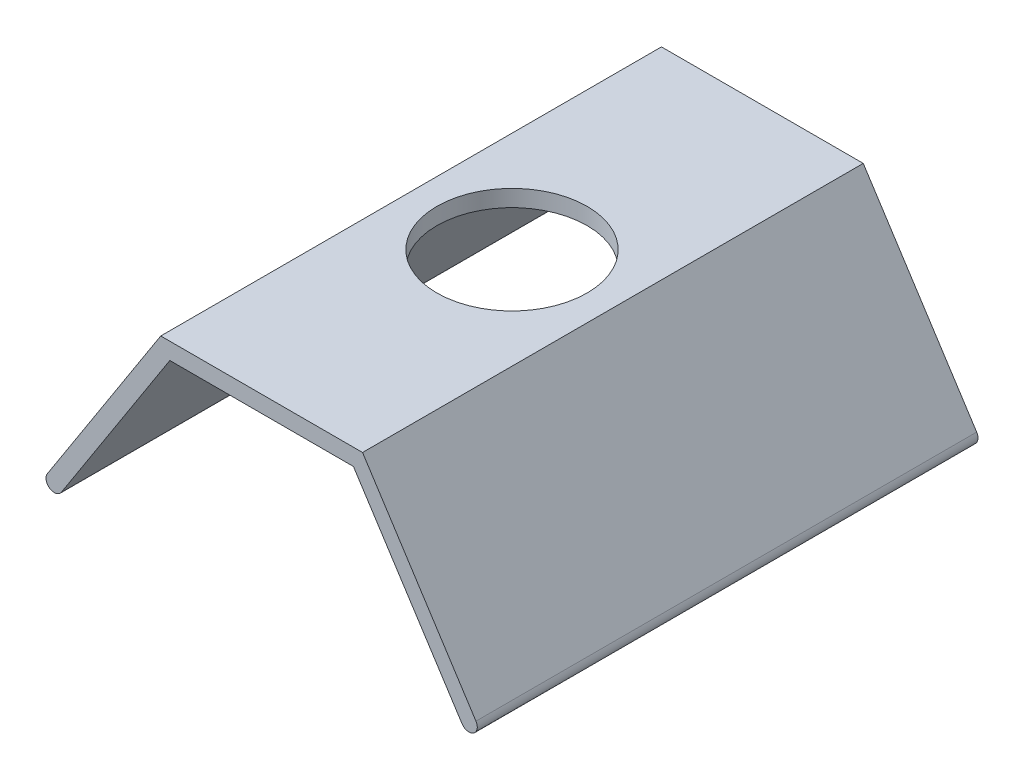
from build123d import *

# Parameters (mm, degrees)
BOSS_EXTRUDE1_DEPTH  = 7.5
M4_CLEARANCE_HOLE1_D = 4.5


with BuildPart() as part:
    # Sketch1 → Boss-Extrude1 (new, symmetric)
    with BuildSketch(Plane.XY):
        with BuildLine():
            Line((-2.75, 0), (2.75, 0))
            Line((2.75, 0), (6, -5.04356025))
            ThreePointArc((6, -5.04356025), (6.34556501, -5.118291928), (6.420296688, -4.772726917))
            Line((6.420296688, -4.772726917), (3.022624878, 0.5))
            Line((3.022624878, 0.5), (-3.022624878, 0.5))
            Line((-3.022624878, 0.5), (-6.420296688, -4.772726917))
            ThreePointArc((-6.420296688, -4.772726917), (-6.34556501, -5.118291928), (-6, -5.04356025))
            Line((-6, -5.04356025), (-2.75, 0))
        make_face()
    extrude(amount=BOSS_EXTRUDE1_DEPTH, both=True)

    # M4 Clearance Hole1 (through all)
    with Locations(Plane(origin=(0, 0.5, 0), x_dir=(1, 0, 0), z_dir=(0, 1, 0))):
        with Locations((0, 0)):
            Hole(M4_CLEARANCE_HOLE1_D / 2)


solid = part.part
